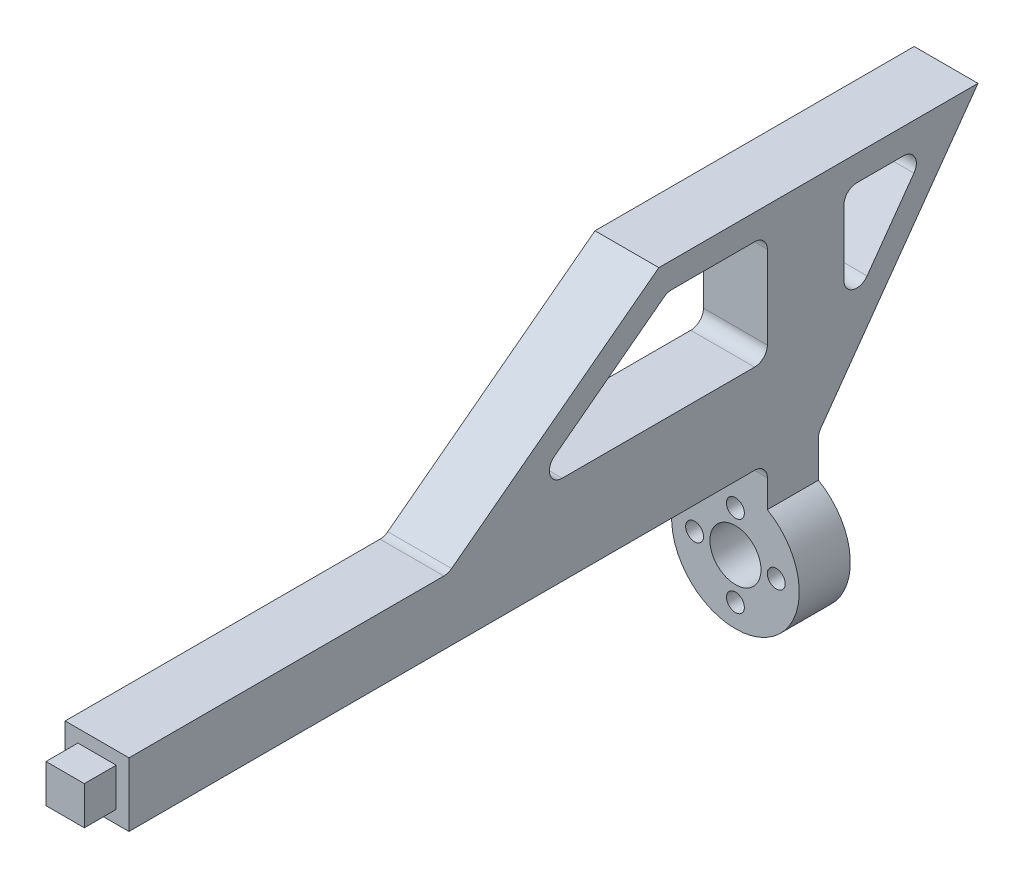
from build123d import *

# Parameters (mm, degrees)
SKETCH1_R           = 5.08
SKETCH1_R_2         = 1.778
BOSS_EXTRUDE1_DEPTH = 10.16
SKETCH3_W           = 12.7
SKETCH3_H           = 12.7
BOSS_EXTRUDE2_DEPTH = 127
SKETCH6_W           = 7.62
SKETCH6_H           = 7.62
BOSS_EXTRUDE3_DEPTH = 6.35
BOSS_EXTRUDE4_START = -12.7
BOSS_EXTRUDE4_DEPTH = 12.7
FILLET2_R           = 2.54
BOSS_EXTRUDE5_START = -12.7
BOSS_EXTRUDE5_DEPTH = 12.7
FILLET3_R           = 2.54


with BuildPart() as part:
    # Sketch1 → Boss-Extrude1 (new body)
    with BuildSketch(Plane.XY):
        with BuildLine():
            Line((-6.35, 12.7), (-6.35, 10.998522628))
            ThreePointArc((-6.35, 10.998522628), (0, -12.7), (6.35, 10.998522628))
            Line((6.35, 10.998522628), (6.35, 12.7))
            Line((6.35, 12.7), (6.35, 63.5))
            Line((6.35, 63.5), (-6.35, 63.5))
            Line((-6.35, 63.5), (-6.35, 12.7))
        make_face()
        Circle(SKETCH1_R, mode=Mode.SUBTRACT)
        with Locations((0, 8.128)):
            Circle(SKETCH1_R_2, mode=Mode.SUBTRACT)
        with Locations((8.128, 0)):
            Circle(SKETCH1_R_2, mode=Mode.SUBTRACT)
        with Locations((0, -8.128)):
            Circle(SKETCH1_R_2, mode=Mode.SUBTRACT)
        with Locations((-8.128, 0)):
            Circle(SKETCH1_R_2, mode=Mode.SUBTRACT)
    extrude(amount=BOSS_EXTRUDE1_DEPTH)

    # Sketch3 → Boss-Extrude2 (add)
    with BuildSketch(Plane.XY.offset(10.16)):
        with Locations((0, 25.4)):
            Rectangle(SKETCH3_W, SKETCH3_H)
    extrude(amount=BOSS_EXTRUDE2_DEPTH)

    # Sketch6 → Boss-Extrude3 (add)
    with BuildSketch(Plane.XY.offset(137.16)):
        with Locations((0, 25.4)):
            Rectangle(SKETCH6_W, SKETCH6_H)
    extrude(amount=BOSS_EXTRUDE3_DEPTH)

    # Sketch5 → Boss-Extrude4 (add)
    with BuildSketch(Plane.ZY.offset(6.35).offset(BOSS_EXTRUDE4_START)):
        Polygon((10.16, 63.5), (31.75, 63.5), (73.66, 31.75), (10.16, 31.75), (10.16, 36.83), (58.541821836, 36.83), (30.043021836, 58.42), (10.16, 58.42), align=None)
    extrude(amount=BOSS_EXTRUDE4_DEPTH)

    # Fillet2
    fillet2_edges = [part.edges().sort_by_distance(p)[0] for p in [
        (0, 31.75, 73.66),
    ]]
    fillet(fillet2_edges, radius=FILLET2_R)

    # Sketch7 → Boss-Extrude5 (add)
    with BuildSketch(Plane(origin=(6.35, 0, 0), x_dir=(0, 0, -1), z_dir=(1, 0, 0)).offset(BOSS_EXTRUDE5_START)):
        Polygon((0, 63.5), (0, 19.05), (31.75, 63.5), align=None)
        Polygon((5.08, 58.42), (21.878598235, 58.42), (5.08, 34.901962471), align=None, mode=Mode.SUBTRACT)
    extrude(amount=BOSS_EXTRUDE5_DEPTH)

    # Fillet3
    fillet3_edges = [part.edges().sort_by_distance(p)[0] for p in [
        (0, 19.05, 0),
        (0, 34.901962471, -5.08),
        (0, 58.42, -5.08),
        (0, 58.42, -21.878598235),
        (0, 19.05, 10.16),
        (0, 58.42, 10.16),
        (0, 58.42, 30.043021836),
        (0, 36.83, 58.541821836),
        (0, 36.83, 10.16),
    ]]
    fillet(fillet3_edges, radius=FILLET3_R)


solid = part.part
